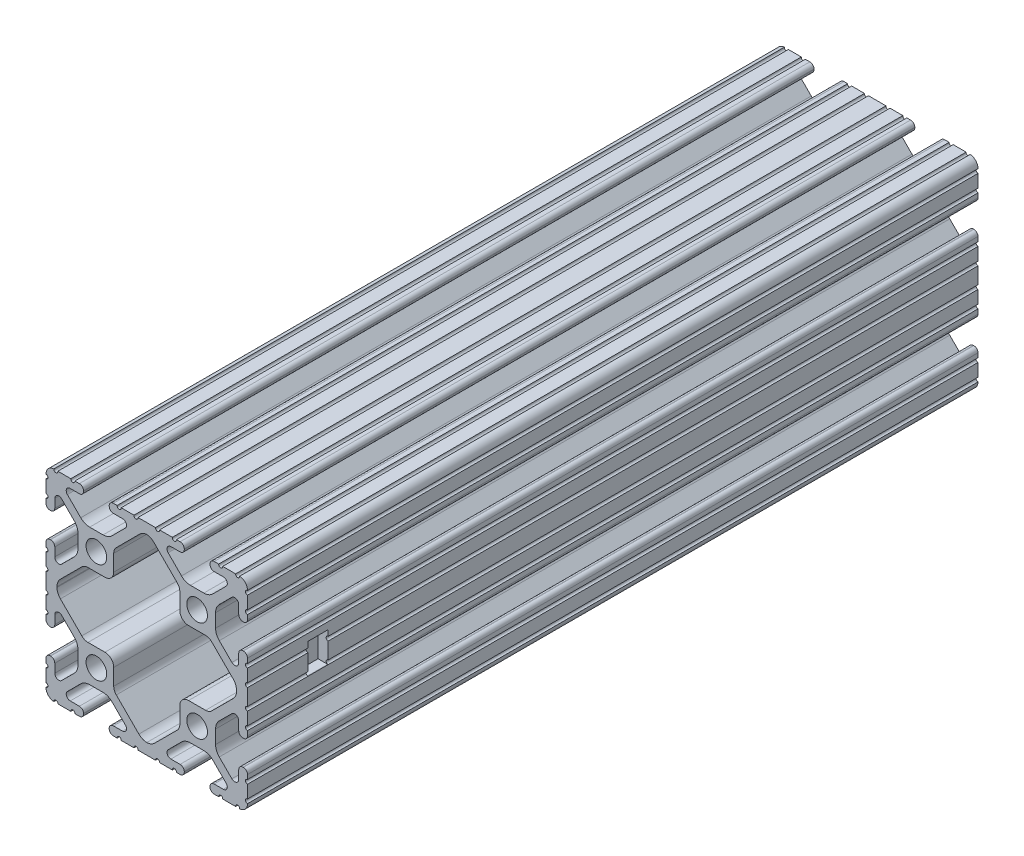
from build123d import *

# Parameters (mm, degrees)
SKETCH1_R           = 2.6035
BOSS_EXTRUDE1_DEPTH = 92.075
SKETCH3_W           = 5.08
SKETCH3_H           = 7.62
CUT_EXTRUDE3_DEPTH  = 2.54
CUT_EXTRUDE4_START  = -50.8
SKETCH3_2_W         = 5.08
SKETCH3_2_H         = 7.62
CUT_EXTRUDE4_DEPTH  = 2.54


with BuildPart() as part:
    # Sketch1 → Boss-Extrude1 (new, symmetric)
    with BuildSketch(Plane.XY):
        with BuildLine():
            Line((7.45792614, -25.4), (8.405130016, -25.4))
            ThreePointArc((8.405130016, -25.4), (9.151169169, -25.100362415), (9.461500022, -24.358707602))
            Line((9.461500022, -24.358707602), (9.461500022, -24.231492399))
            ThreePointArc((9.461500022, -24.231492399), (9.151169171, -23.489837577), (8.405130016, -23.1902))
            Line((8.405130016, -23.1902), (6.087754002, -23.1902))
            ThreePointArc((6.087754002, -23.1902), (5.173448619, -22.579280675), (5.387974958, -21.500783941))
            Line((5.387974958, -21.500783941), (8.763022929, -18.12573597))
            ThreePointArc((8.763022929, -18.12573597), (9.793067061, -17.437482484), (11.008086959, -17.1958))
            Line((11.008086959, -17.1958), (14.391913041, -17.1958))
            ThreePointArc((14.391913041, -17.1958), (15.606932939, -17.437482484), (16.636977071, -18.12573597))
            Line((16.636977071, -18.12573597), (20.012025042, -21.500783941))
            ThreePointArc((20.012025042, -21.500783941), (20.223734168, -22.586011733), (19.297652818, -23.190092399))
            Line((19.297652818, -23.190092399), (16.9799, -23.190092399))
            ThreePointArc((16.9799, -23.190092399), (16.243518998, -23.495111397), (15.9385, -24.231492399))
            Line((15.9385, -24.231492399), (15.9385, -24.358707602))
            ThreePointArc((15.9385, -24.358707602), (16.248830571, -25.100362128), (16.994869211, -25.4))
            Line((16.994869211, -25.4), (18.134015685, -25.4))
            ThreePointArc((18.134015685, -25.4), (18.636212411, -24.815433371), (19.138409137, -25.4))
            Line((19.138409137, -25.4), (22.413213213, -25.4))
            ThreePointArc((22.413213213, -25.4), (22.915409939, -24.815433371), (23.417606664, -25.4))
            Line((23.417606664, -25.4), (23.450057096, -25.4))
            ThreePointArc((23.450057096, -25.4), (24.837463446, -24.731428565), (25.4, -23.29774975))
            Line((25.4, -23.29774975), (25.4, -23.268649529))
            ThreePointArc((25.4, -23.268649529), (24.892, -22.760649529), (25.4, -22.252649529))
            Line((25.4, -22.252649529), (25.4, -19.025239356))
            ThreePointArc((25.4, -19.025239356), (24.892, -18.517239356), (25.4, -18.009239356))
            Line((25.4, -18.009239356), (25.4, -16.91604181))
            ThreePointArc((25.4, -16.91604181), (25.094981002, -16.179660808), (24.3586, -15.87464181))
            Line((24.3586, -15.87464181), (24.2316, -15.87464181))
            ThreePointArc((24.2316, -15.87464181), (23.495218998, -16.179660808), (23.1902, -16.91604181))
            Line((23.1902, -16.91604181), (23.1902, -19.100988789))
            ThreePointArc((23.1902, -19.100988789), (22.563006367, -20.039650394), (21.45577951, -19.819409279))
            Line((21.45577951, -19.819409279), (18.27813597, -16.641765738))
            ThreePointArc((18.27813597, -16.641765738), (17.589882484, -15.611721606), (17.3482, -14.396701708))
            Line((17.3482, -14.396701708), (17.3482, -11.003495043))
            ThreePointArc((17.3482, -11.003495043), (17.590610762, -9.786718415), (18.280827, -8.755743204))
            Line((18.280827, -8.755743204), (21.45664064, -5.587529241))
            ThreePointArc((21.45664064, -5.587529241), (22.563568521, -5.368381274), (23.1902, -6.30680983))
            Line((23.1902, -6.30680983), (23.1902, -8.48395819))
            ThreePointArc((23.1902, -8.48395819), (23.495218998, -9.220339192), (24.2316, -9.52535819))
            Line((24.2316, -9.52535819), (24.3586, -9.52535819))
            ThreePointArc((24.3586, -9.52535819), (25.094981002, -9.220339192), (25.4, -8.48395819))
            Line((25.4, -8.48395819), (25.4, -7.327686685))
            ThreePointArc((25.4, -7.327686685), (24.892, -6.819686685), (25.4, -6.311686685))
            Line((25.4, -6.311686685), (25.4, -3.084276513))
            ThreePointArc((25.4, -3.084276513), (24.892, -2.576276513), (25.4, -2.068276513))
            Line((25.4, -2.068276513), (25.4, 2.068276513))
            ThreePointArc((25.4, 2.068276513), (24.892, 2.576276513), (25.4, 3.084276513))
            Line((25.4, 3.084276513), (25.4, 6.311686685))
            ThreePointArc((25.4, 6.311686685), (24.892, 6.819686685), (25.4, 7.327686685))
            Line((25.4, 7.327686685), (25.4, 8.48395819))
            ThreePointArc((25.4, 8.48395819), (25.094981002, 9.220339192), (24.3586, 9.52535819))
            Line((24.3586, 9.52535819), (24.2316, 9.52535819))
            ThreePointArc((24.2316, 9.52535819), (23.495218998, 9.220339192), (23.1902, 8.48395819))
            Line((23.1902, 8.48395819), (23.1902, 6.30680983))
            ThreePointArc((23.1902, 6.30680983), (22.563568521, 5.368381274), (21.45664064, 5.587529241))
            Line((21.45664064, 5.587529241), (18.280827, 8.755743204))
            ThreePointArc((18.280827, 8.755743204), (17.590610762, 9.786718415), (17.3482, 11.003495043))
            Line((17.3482, 11.003495043), (17.3482, 14.396701708))
            ThreePointArc((17.3482, 14.396701708), (17.589882484, 15.611721606), (18.27813597, 16.641765738))
            Line((18.27813597, 16.641765738), (21.45577951, 19.819409279))
            ThreePointArc((21.45577951, 19.819409279), (22.563006367, 20.039650394), (23.1902, 19.100988789))
            Line((23.1902, 19.100988789), (23.1902, 16.91604181))
            ThreePointArc((23.1902, 16.91604181), (23.495218998, 16.179660808), (24.2316, 15.87464181))
            Line((24.2316, 15.87464181), (24.3586, 15.87464181))
            ThreePointArc((24.3586, 15.87464181), (25.094981002, 16.179660808), (25.4, 16.91604181))
            Line((25.4, 16.91604181), (25.4, 18.009239356))
            ThreePointArc((25.4, 18.009239356), (24.892, 18.517239356), (25.4, 19.025239356))
            Line((25.4, 19.025239356), (25.4, 22.252649529))
            ThreePointArc((25.4, 22.252649529), (24.892, 22.760649529), (25.4, 23.268649529))
            Line((25.4, 23.268649529), (25.4, 23.29774975))
            ThreePointArc((25.4, 23.29774975), (24.837462256, 24.73142746), (23.450057096, 25.4))
            Line((23.450057096, 25.4), (23.417606664, 25.4))
            ThreePointArc((23.417606664, 25.4), (22.915409939, 24.815433371), (22.413213213, 25.4))
            Line((22.413213213, 25.4), (19.138409137, 25.4))
            ThreePointArc((19.138409137, 25.4), (18.636212411, 24.815433371), (18.134015685, 25.4))
            Line((18.134015685, 25.4), (16.994869211, 25.4))
            ThreePointArc((16.994869211, 25.4), (16.248830563, 25.100362136), (15.9385, 24.358707602))
            Line((15.9385, 24.358707602), (15.9385, 24.231492399))
            ThreePointArc((15.9385, 24.231492399), (16.243518998, 23.495111397), (16.9799, 23.190092399))
            Line((16.9799, 23.190092399), (19.297652818, 23.190092399))
            ThreePointArc((19.297652818, 23.190092399), (20.223734168, 22.586011733), (20.012025042, 21.500783941))
            Line((20.012025042, 21.500783941), (16.636977071, 18.12573597))
            ThreePointArc((16.636977071, 18.12573597), (15.606932939, 17.437482484), (14.391913041, 17.1958))
            Line((14.391913041, 17.1958), (11.008086959, 17.1958))
            ThreePointArc((11.008086959, 17.1958), (9.793067061, 17.437482484), (8.763022929, 18.12573597))
            Line((8.763022929, 18.12573597), (5.387974958, 21.500783941))
            ThreePointArc((5.387974958, 21.500783941), (5.173448619, 22.579280675), (6.087754002, 23.1902))
            Line((6.087754002, 23.1902), (8.405130016, 23.1902))
            ThreePointArc((8.405130016, 23.1902), (9.151169155, 23.489837593), (9.4615, 24.231492399))
            Line((9.4615, 24.231492399), (9.4615, 24.358707602))
            ThreePointArc((9.4615, 24.358707602), (9.151169154, 25.100362399), (8.405130016, 25.4))
            Line((8.405130016, 25.4), (7.45792614, 25.4))
            ThreePointArc((7.45792614, 25.4), (6.955729414, 24.815433371), (6.453532688, 25.4))
            Line((6.453532688, 25.4), (3.214515968, 25.4))
            ThreePointArc((3.214515968, 25.4), (2.712319242, 24.815433371), (2.210122516, 25.4))
            Line((2.210122516, 25.4), (-2.210122516, 25.4))
            ThreePointArc((-2.210122516, 25.4), (-2.712319242, 24.815433371), (-3.214515968, 25.4))
            Line((-3.214515968, 25.4), (-6.453532688, 25.4))
            ThreePointArc((-6.453532688, 25.4), (-6.955729414, 24.815433371), (-7.45792614, 25.4))
            Line((-7.45792614, 25.4), (-8.405130016, 25.4))
            ThreePointArc((-8.405130016, 25.4), (-9.151169169, 25.100362415), (-9.461500022, 24.358707602))
            Line((-9.461500022, 24.358707602), (-9.461500022, 24.231492399))
            ThreePointArc((-9.461500022, 24.231492399), (-9.151169171, 23.489837577), (-8.405130016, 23.1902))
            Line((-8.405130016, 23.1902), (-6.087754002, 23.1902))
            ThreePointArc((-6.087754002, 23.1902), (-5.173448619, 22.579280675), (-5.387974958, 21.500783941))
            Line((-5.387974958, 21.500783941), (-8.763022929, 18.12573597))
            ThreePointArc((-8.763022929, 18.12573597), (-9.793067061, 17.437482484), (-11.008086959, 17.1958))
            Line((-11.008086959, 17.1958), (-14.391913041, 17.1958))
            ThreePointArc((-14.391913041, 17.1958), (-15.606932939, 17.437482484), (-16.636977071, 18.12573597))
            Line((-16.636977071, 18.12573597), (-20.012025042, 21.500783941))
            ThreePointArc((-20.012025042, 21.500783941), (-20.223734168, 22.586011733), (-19.297652818, 23.190092399))
            Line((-19.297652818, 23.190092399), (-16.9799, 23.190092399))
            ThreePointArc((-16.9799, 23.190092399), (-16.243518998, 23.495111397), (-15.9385, 24.231492399))
            Line((-15.9385, 24.231492399), (-15.9385, 24.358707602))
            ThreePointArc((-15.9385, 24.358707602), (-16.248830571, 25.100362128), (-16.994869211, 25.4))
            Line((-16.994869211, 25.4), (-18.134015685, 25.4))
            ThreePointArc((-18.134015685, 25.4), (-18.636212411, 24.815433371), (-19.138409137, 25.4))
            Line((-19.138409137, 25.4), (-22.413213213, 25.4))
            ThreePointArc((-22.413213213, 25.4), (-22.915409939, 24.815433371), (-23.417606664, 25.4))
            Line((-23.417606664, 25.4), (-23.450057096, 25.4))
            ThreePointArc((-23.450057096, 25.4), (-24.837463446, 24.731428565), (-25.4, 23.29774975))
            Line((-25.4, 23.29774975), (-25.4, 23.268649529))
            ThreePointArc((-25.4, 23.268649529), (-24.892, 22.760649529), (-25.4, 22.252649529))
            Line((-25.4, 22.252649529), (-25.4, 19.025239356))
            ThreePointArc((-25.4, 19.025239356), (-24.892, 18.517239356), (-25.4, 18.009239356))
            Line((-25.4, 18.009239356), (-25.4, 16.91604181))
            ThreePointArc((-25.4, 16.91604181), (-25.094981002, 16.179660808), (-24.3586, 15.87464181))
            Line((-24.3586, 15.87464181), (-24.2316, 15.87464181))
            ThreePointArc((-24.2316, 15.87464181), (-23.495218998, 16.179660808), (-23.1902, 16.91604181))
            Line((-23.1902, 16.91604181), (-23.1902, 19.100988789))
            ThreePointArc((-23.1902, 19.100988789), (-22.563006367, 20.039650394), (-21.45577951, 19.819409279))
            Line((-21.45577951, 19.819409279), (-18.27813597, 16.641765738))
            ThreePointArc((-18.27813597, 16.641765738), (-17.589882484, 15.611721606), (-17.3482, 14.396701708))
            Line((-17.3482, 14.396701708), (-17.3482, 11.003495043))
            ThreePointArc((-17.3482, 11.003495043), (-17.590610762, 9.786718415), (-18.280827, 8.755743204))
            Line((-18.280827, 8.755743204), (-21.45664064, 5.587529241))
            ThreePointArc((-21.45664064, 5.587529241), (-22.563568521, 5.368381274), (-23.1902, 6.30680983))
            Line((-23.1902, 6.30680983), (-23.1902, 8.48395819))
            ThreePointArc((-23.1902, 8.48395819), (-23.495218998, 9.220339192), (-24.2316, 9.52535819))
            Line((-24.2316, 9.52535819), (-24.3586, 9.52535819))
            ThreePointArc((-24.3586, 9.52535819), (-25.094981002, 9.220339192), (-25.4, 8.48395819))
            Line((-25.4, 8.48395819), (-25.4, 7.327686685))
            ThreePointArc((-25.4, 7.327686685), (-24.892, 6.819686685), (-25.4, 6.311686685))
            Line((-25.4, 6.311686685), (-25.4, 3.084276513))
            ThreePointArc((-25.4, 3.084276513), (-24.892, 2.576276513), (-25.4, 2.068276513))
            Line((-25.4, 2.068276513), (-25.4, -2.068276513))
            ThreePointArc((-25.4, -2.068276513), (-24.892, -2.576276513), (-25.4, -3.084276513))
            Line((-25.4, -3.084276513), (-25.4, -6.311686685))
            ThreePointArc((-25.4, -6.311686685), (-24.892, -6.819686685), (-25.4, -7.327686685))
            Line((-25.4, -7.327686685), (-25.4, -8.48395819))
            ThreePointArc((-25.4, -8.48395819), (-25.094981002, -9.220339192), (-24.3586, -9.52535819))
            Line((-24.3586, -9.52535819), (-24.2316, -9.52535819))
            ThreePointArc((-24.2316, -9.52535819), (-23.495218998, -9.220339192), (-23.1902, -8.48395819))
            Line((-23.1902, -8.48395819), (-23.1902, -6.30680983))
            ThreePointArc((-23.1902, -6.30680983), (-22.563568521, -5.368381274), (-21.45664064, -5.587529241))
            Line((-21.45664064, -5.587529241), (-18.280827, -8.755743204))
            ThreePointArc((-18.280827, -8.755743204), (-17.590610762, -9.786718415), (-17.3482, -11.003495043))
            Line((-17.3482, -11.003495043), (-17.3482, -14.396701708))
            ThreePointArc((-17.3482, -14.396701708), (-17.589882484, -15.611721606), (-18.27813597, -16.641765738))
            Line((-18.27813597, -16.641765738), (-21.45577951, -19.819409279))
            ThreePointArc((-21.45577951, -19.819409279), (-22.563006367, -20.039650394), (-23.1902, -19.100988789))
            Line((-23.1902, -19.100988789), (-23.1902, -16.91604181))
            ThreePointArc((-23.1902, -16.91604181), (-23.495218998, -16.179660808), (-24.2316, -15.87464181))
            Line((-24.2316, -15.87464181), (-24.3586, -15.87464181))
            ThreePointArc((-24.3586, -15.87464181), (-25.094981002, -16.179660808), (-25.4, -16.91604181))
            Line((-25.4, -16.91604181), (-25.4, -18.009239356))
            ThreePointArc((-25.4, -18.009239356), (-24.892, -18.517239356), (-25.4, -19.025239356))
            Line((-25.4, -19.025239356), (-25.4, -22.252649529))
            ThreePointArc((-25.4, -22.252649529), (-24.892, -22.760649529), (-25.4, -23.268649529))
            Line((-25.4, -23.268649529), (-25.4, -23.29774975))
            ThreePointArc((-25.4, -23.29774975), (-24.837462256, -24.73142746), (-23.450057096, -25.4))
            Line((-23.450057096, -25.4), (-23.417606664, -25.4))
            ThreePointArc((-23.417606664, -25.4), (-22.915409939, -24.815433371), (-22.413213213, -25.4))
            Line((-22.413213213, -25.4), (-19.138409137, -25.4))
            ThreePointArc((-19.138409137, -25.4), (-18.636212411, -24.815433371), (-18.134015685, -25.4))
            Line((-18.134015685, -25.4), (-16.994869211, -25.4))
            ThreePointArc((-16.994869211, -25.4), (-16.248830563, -25.100362136), (-15.9385, -24.358707602))
            Line((-15.9385, -24.358707602), (-15.9385, -24.231492399))
            ThreePointArc((-15.9385, -24.231492399), (-16.243518998, -23.495111397), (-16.9799, -23.190092399))
            Line((-16.9799, -23.190092399), (-19.297652818, -23.190092399))
            ThreePointArc((-19.297652818, -23.190092399), (-20.223734168, -22.586011733), (-20.012025042, -21.500783941))
            Line((-20.012025042, -21.500783941), (-16.636977071, -18.12573597))
            ThreePointArc((-16.636977071, -18.12573597), (-15.606932939, -17.437482484), (-14.391913041, -17.1958))
            Line((-14.391913041, -17.1958), (-11.008086959, -17.1958))
            ThreePointArc((-11.008086959, -17.1958), (-9.793067061, -17.437482484), (-8.763022929, -18.12573597))
            Line((-8.763022929, -18.12573597), (-5.387974958, -21.500783941))
            ThreePointArc((-5.387974958, -21.500783941), (-5.173448619, -22.579280675), (-6.087754002, -23.1902))
            Line((-6.087754002, -23.1902), (-8.405130016, -23.1902))
            ThreePointArc((-8.405130016, -23.1902), (-9.151169155, -23.489837593), (-9.4615, -24.231492399))
            Line((-9.4615, -24.231492399), (-9.4615, -24.358707602))
            ThreePointArc((-9.4615, -24.358707602), (-9.151169154, -25.100362399), (-8.405130016, -25.4))
            Line((-8.405130016, -25.4), (-7.45792614, -25.4))
            ThreePointArc((-7.45792614, -25.4), (-6.955729414, -24.815433371), (-6.453532688, -25.4))
            Line((-6.453532688, -25.4), (-3.214515968, -25.4))
            ThreePointArc((-3.214515968, -25.4), (-2.712319242, -24.815433371), (-2.210122516, -25.4))
            Line((-2.210122516, -25.4), (2.210122516, -25.4))
            ThreePointArc((2.210122516, -25.4), (2.712319242, -24.815433371), (3.214515968, -25.4))
            Line((3.214515968, -25.4), (6.453532688, -25.4))
            ThreePointArc((6.453532688, -25.4), (6.955729414, -24.815433371), (7.45792614, -25.4))
        make_face()
        with Locations((-12.7, 12.7)):
            Circle(SKETCH1_R, mode=Mode.SUBTRACT)
        with Locations((12.7, 12.7)):
            Circle(SKETCH1_R, mode=Mode.SUBTRACT)
        with Locations((12.7, -12.7)):
            Circle(SKETCH1_R, mode=Mode.SUBTRACT)
        with Locations((-12.7, -12.7)):
            Circle(SKETCH1_R, mode=Mode.SUBTRACT)
        with BuildLine():
            Line((-7.683964565, -16.079665203), (-1.987770861, -21.775858908))
            ThreePointArc((-1.987770861, -21.775858908), (-1.075921771, -22.393947165), (0, -22.630366707))
            ThreePointArc((0, -22.630366707), (1.075921771, -22.393947165), (1.987770861, -21.775858908))
            Line((1.987770861, -21.775858908), (7.683964565, -16.079665203))
            ThreePointArc((7.683964565, -16.079665203), (8.162988991, -15.362754487), (8.3312, -14.517100638))
            Line((8.3312, -14.517100638), (8.3312, -10.3886))
            ThreePointArc((8.3312, -10.3886), (8.978435435, -8.826035435), (10.541, -8.1788))
            Line((10.541, -8.1788), (14.816495758, -8.1788))
            ThreePointArc((14.816495758, -8.1788), (15.66092662, -8.01109514), (16.377187366, -7.53343528))
            Line((16.377187366, -7.53343528), (21.77338316, -2.150152507))
            ThreePointArc((21.77338316, -2.150152507), (22.408382099, -1.201655313), (22.6314, -0.082220815))
            Line((22.6314, -0.082220815), (22.6314, 0.082220815))
            ThreePointArc((22.6314, 0.082220815), (22.408382099, 1.201655313), (21.77338316, 2.150152507))
            Line((21.77338316, 2.150152507), (16.376754096, 7.533867514))
            ThreePointArc((16.376754096, 7.533867514), (15.660493349, 8.011527374), (14.816062488, 8.179232234))
            Line((14.816062488, 8.179232234), (10.541, 8.179232234))
            ThreePointArc((10.541, 8.179232234), (8.978435435, 8.826467669), (8.3312, 10.389032234))
            Line((8.3312, 10.389032234), (8.3312, 14.517100638))
            ThreePointArc((8.3312, 14.517100638), (8.162988991, 15.362754487), (7.683964565, 16.079665203))
            Line((7.683964565, 16.079665203), (1.795557487, 21.968072281))
            ThreePointArc((1.795557487, 21.968072281), (0.97153248, 22.546678968), (0, 22.811117151))
            ThreePointArc((0, 22.811117151), (-0.97153248, 22.546678968), (-1.795557487, 21.968072281))
            Line((-1.795557487, 21.968072281), (-7.683964565, 16.079665203))
            ThreePointArc((-7.683964565, 16.079665203), (-8.162988991, 15.362754487), (-8.3312, 14.517100638))
            Line((-8.3312, 14.517100638), (-8.3312, 10.3886))
            ThreePointArc((-8.3312, 10.3886), (-8.978435435, 8.826035435), (-10.541, 8.1788))
            Line((-10.541, 8.1788), (-14.816495758, 8.1788))
            ThreePointArc((-14.816495758, 8.1788), (-15.66092662, 8.01109514), (-16.377187366, 7.53343528))
            Line((-16.377187366, 7.53343528), (-21.77338316, 2.150152507))
            ThreePointArc((-21.77338316, 2.150152507), (-22.408382099, 1.201655313), (-22.6314, 0.082220815))
            Line((-22.6314, 0.082220815), (-22.6314, -0.082220815))
            ThreePointArc((-22.6314, -0.082220815), (-22.408382099, -1.201655313), (-21.77338316, -2.150152507))
            Line((-21.77338316, -2.150152507), (-16.377187366, -7.53343528))
            ThreePointArc((-16.377187366, -7.53343528), (-15.66092662, -8.01109514), (-14.816495758, -8.1788))
            Line((-14.816495758, -8.1788), (-10.541, -8.1788))
            ThreePointArc((-10.541, -8.1788), (-8.978435435, -8.826035435), (-8.3312, -10.3886))
            Line((-8.3312, -10.3886), (-8.3312, -14.517100638))
            ThreePointArc((-8.3312, -14.517100638), (-8.162988991, -15.362754487), (-7.683964565, -16.079665203))
        make_face(mode=Mode.SUBTRACT)
    extrude(amount=BOSS_EXTRUDE1_DEPTH, both=True)

    # Sketch3 → Cut-Extrude3 (cut)
    with BuildSketch(Plane.ZY.offset(25.4)):
        with Locations((74.295, 0.739068426)):
            Rectangle(SKETCH3_W, SKETCH3_H)
    extrude(amount=-CUT_EXTRUDE3_DEPTH, mode=Mode.SUBTRACT)

    # Sketch3<2> → Cut-Extrude4 (cut)
    with BuildSketch(Plane.ZY.offset(25.4).offset(CUT_EXTRUDE4_START)):
        with Locations((74.295, 0.739068426)):
            Rectangle(SKETCH3_2_W, SKETCH3_2_H)
    extrude(amount=CUT_EXTRUDE4_DEPTH, mode=Mode.SUBTRACT)


solid = part.part
